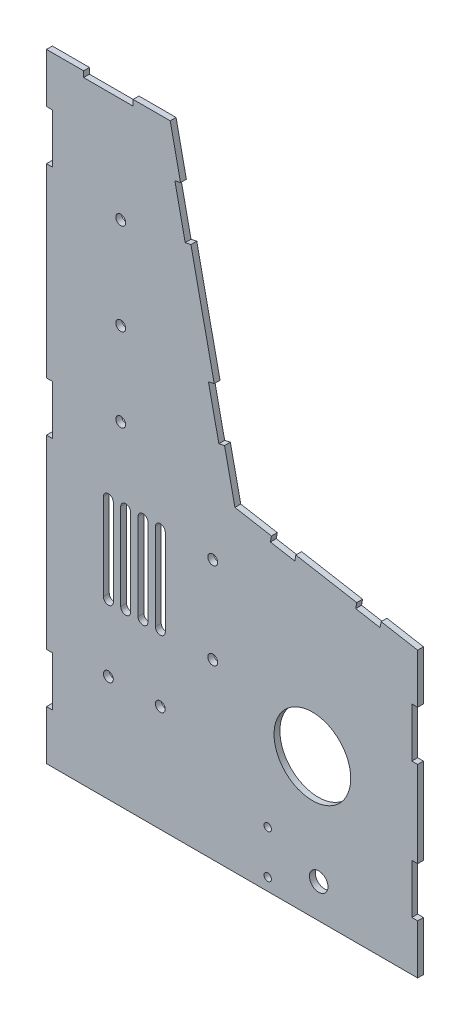
from build123d import *

# Parameters (mm, degrees)
BOSS_EXTRUDE1_DEPTH = 2.3622
SKETCH2_R           = 2
SKETCH2_R_2         = 3.75
SKETCH2_R_3         = 1.5
SKETCH2_R_4         = 15.5
CUT_EXTRUDE1_DEPTH  = 292.557164187


with BuildPart() as part:
    # Sketch1 → Boss-Extrude1 (new body)
    with BuildSketch(Plane.XY):
        Polygon((0, 0), (150, 0), (150, 20), (147.6378, 20), (147.6378, 40), (150, 40), (150, 74.740014023), (147.6378, 74.740014023), (147.6378, 94.740014023), (150, 94.740014023), (150, 114.740014023), (135.227883705, 117.344736688), (134.81769198, 115.018423813), (124.969614449, 116.75490559), (125.379806175, 119.081218464), (100.759612349, 123.422422906), (100.349420624, 121.096110032), (90.501343094, 122.832591808), (90.911534819, 125.158904683), (76.139418524, 127.763627348), (71.95711156, 147.321446972), (69.647137484, 146.827474696), (65.464830521, 166.385294321), (67.774804596, 166.879266596), (58.364613928, 210.884360751), (56.054639852, 210.390388476), (51.872332888, 229.9482081), (54.182306964, 230.442180376), (50, 250), (35, 250), (35, 247.6378), (15, 247.6378), (15, 250), (0, 250), (0, 230), (2.3622, 230), (2.3622, 210), (0, 210), (0, 135), (2.3622, 135), (2.3622, 115), (0, 115), (0, 40), (2.3622, 40), (2.3622, 20), (0, 20), align=None)
    extrude(amount=BOSS_EXTRUDE1_DEPTH)

    # Sketch2 → Cut-Extrude1 (cut, through all)
    with BuildSketch(Plane.XY.offset(2.3622)):
        with Locations((30, 168.301817255)):
            Circle(SKETCH2_R)
        with Locations((67.180515984, 70)):
            Circle(SKETCH2_R)
        with Locations((46, 43.014719635)):
            Circle(SKETCH2_R)
        with Locations((67.180515984, 105)):
            Circle(SKETCH2_R)
        with Locations((25, 43.014719635)):
            Circle(SKETCH2_R)
        with Locations((30, 205.319678906)):
            Circle(SKETCH2_R)
        with Locations((30, 134.64241622)):
            Circle(SKETCH2_R)
        with Locations((110, 13.75)):
            Circle(SKETCH2_R_2)
        with Locations((89.4, 22.5)):
            Circle(SKETCH2_R_3)
        with Locations((89.4, 5)):
            Circle(SKETCH2_R_3)
        with Locations((107.457467604, 56.31719907)):
            Circle(SKETCH2_R_4)
        with BuildLine():
            Line((41, 105), (41, 70))
            ThreePointArc((41, 70), (39, 68), (37, 70))
            Line((37, 70), (37, 105))
            ThreePointArc((37, 105), (39, 107), (41, 105))
        make_face()
        with BuildLine():
            Line((48, 105), (48, 70))
            ThreePointArc((48, 70), (46, 68), (44, 70))
            Line((44, 70), (44, 105))
            ThreePointArc((44, 105), (46, 107), (48, 105))
        make_face()
        with BuildLine():
            Line((34, 105), (34, 70))
            ThreePointArc((34, 70), (32, 68), (30, 70))
            Line((30, 70), (30, 105))
            ThreePointArc((30, 105), (32, 107), (34, 105))
        make_face()
        with BuildLine():
            Line((27, 105), (27, 70))
            ThreePointArc((27, 70), (25, 68), (23, 70))
            Line((23, 70), (23, 105))
            ThreePointArc((23, 105), (25, 107), (27, 105))
        make_face()
    extrude(amount=-CUT_EXTRUDE1_DEPTH, mode=Mode.SUBTRACT)


solid = part.part
